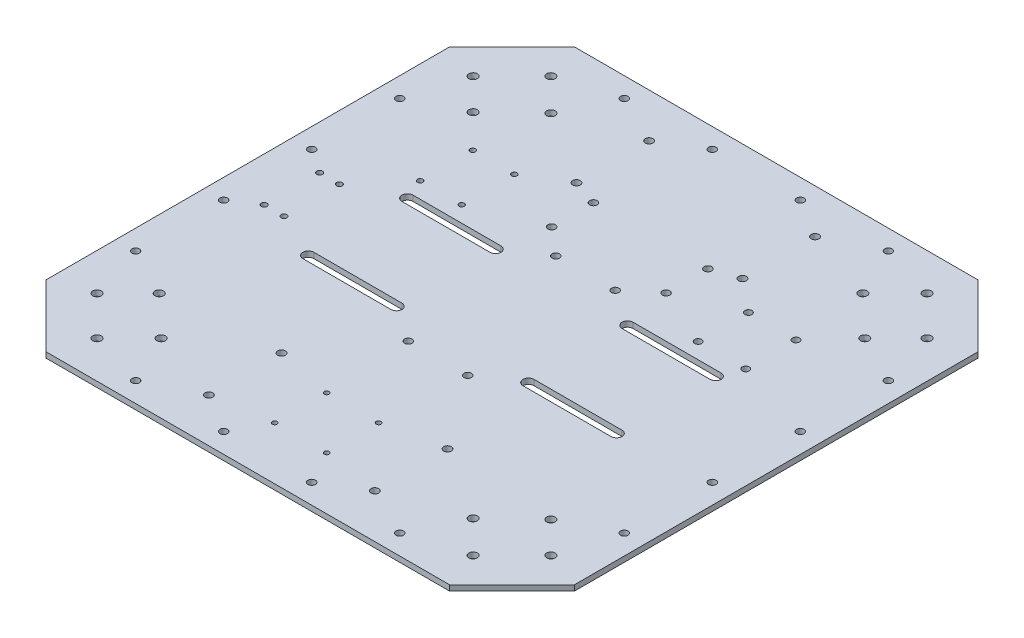
from build123d import *

# Parameters (mm, degrees)
BOSS_EXTRUDE1_DEPTH = 3.175
SKETCH2_R           = 2.4638
CUT_EXTRUDE1_DEPTH  = 6.35
SKETCH3_R           = 2.159
CUT_EXTRUDE2_DEPTH  = 6.35
SKETCH4_R           = 2.2225
CUT_EXTRUDE3_DEPTH  = 351.937720963
SKETCH5_R           = 1.651
CUT_EXTRUDE4_DEPTH  = 351.937720963
SKETCH6_R           = 2.032
SKETCH6_R_2         = 2.159
SKETCH6_R_3         = 1.397
SKETCH6_R_4         = 1.5499969
CUT_EXTRUDE5_DEPTH  = 351.937720963
SKETCH7_R           = 2.159
CUT_EXTRUDE6_DEPTH  = 351.937720963


with BuildPart() as part:
    # Sketch1 → Boss-Extrude1 (new body)
    with BuildSketch(Plane(origin=(0, 0, 0), x_dir=(1, 0, 0), z_dir=(0, 1, 0))):
        Polygon((-25.845025354, 51.656360067), (-61.766049839, 15.735335583), (-61.766049839, -217.222615449), (-25.845025354, -253.143639933), (207.112925677, -253.143639933), (243.033950161, -217.222615449), (243.033950161, 15.735335583), (207.112925677, 51.656360067), align=None)
        with BuildLine():
            ThreePointArc((52.533950161, -126.143639933), (55.708950161, -129.318639933), (52.533950161, -132.493639933))
            Line((52.533950161, -132.493639933), (1.733950161, -132.493639933))
            ThreePointArc((1.733950161, -132.493639933), (-1.441049839, -129.318639933), (1.733950161, -126.143639933))
            Line((1.733950161, -126.143639933), (52.533950161, -126.143639933))
        make_face(mode=Mode.SUBTRACT)
        with BuildLine():
            Line((179.533950161, -132.493639933), (128.733950161, -132.493639933))
            ThreePointArc((128.733950161, -132.493639933), (125.558950161, -129.318639933), (128.733950161, -126.143639933))
            Line((128.733950161, -126.143639933), (179.533950161, -126.143639933))
            ThreePointArc((179.533950161, -126.143639933), (182.708950161, -129.318639933), (179.533950161, -132.493639933))
        make_face(mode=Mode.SUBTRACT)
        with BuildLine():
            Line((1.733950161, -68.993639933), (52.533950161, -68.993639933))
            ThreePointArc((52.533950161, -68.993639933), (55.708950161, -72.168639933), (52.533950161, -75.343639933))
            Line((52.533950161, -75.343639933), (1.733950161, -75.343639933))
            ThreePointArc((1.733950161, -75.343639933), (-1.441049839, -72.168639933), (1.733950161, -68.993639933))
        make_face(mode=Mode.SUBTRACT)
        with BuildLine():
            ThreePointArc((128.733950161, -75.343639933), (125.558950161, -72.168639933), (128.733950161, -68.993639933))
            Line((128.733950161, -68.993639933), (179.533950161, -68.993639933))
            ThreePointArc((179.533950161, -68.993639933), (182.708950161, -72.168639933), (179.533950161, -75.343639933))
            Line((179.533950161, -75.343639933), (128.733950161, -75.343639933))
        make_face(mode=Mode.SUBTRACT)
    extrude(amount=BOSS_EXTRUDE1_DEPTH)

    # Sketch2 → Cut-Extrude1 (cut)
    with BuildSketch(Plane(origin=(0, 3.175, 0), x_dir=(1, 0, 0), z_dir=(0, 1, 0))):
        with Locations(Location((-17.872380726, 30.213331256, 0), (0, 0, 270))):
            Circle(SKETCH2_R)
        with Locations(Location((0.640891541, 11.70005899, 0), (0, 0, 270))):
            Circle(SKETCH2_R)
        with Locations(Location((-22.362508786, -10.197821288, 0), (0, 0, 270))):
            Circle(SKETCH2_R)
        with Locations(Location((-40.323021028, 7.762690954, 0), (0, 0, 270))):
            Circle(SKETCH2_R)
        with Locations(Location((203.630409109, -10.197821288, 0), (0, 0, 270))):
            Circle(SKETCH2_R)
        with Locations(Location((221.590921351, 7.762690954, 0), (0, 0, 270))):
            Circle(SKETCH2_R)
        with Locations(Location((180.627008782, 11.70005899, 0), (0, 0, 270))):
            Circle(SKETCH2_R)
        with Locations(Location((199.140281048, 30.213331256, 0), (0, 0, 270))):
            Circle(SKETCH2_R)
        with Locations(Location((-22.362508786, -191.289458578, 0), (0, 0, 270))):
            Circle(SKETCH2_R)
        with Locations(Location((-40.323021028, -209.24997082, 0), (0, 0, 270))):
            Circle(SKETCH2_R)
        with Locations(Location((-17.872380726, -231.700611123, 0), (0, 0, 270))):
            Circle(SKETCH2_R)
        with Locations(Location((0.640891541, -213.187338857, 0), (0, 0, 270))):
            Circle(SKETCH2_R)
        with Locations(Location((221.590921351, -209.24997082, 0), (0, 0, 270))):
            Circle(SKETCH2_R)
        with Locations(Location((199.140281048, -231.700611123, 0), (0, 0, 270))):
            Circle(SKETCH2_R)
        with Locations(Location((180.627008782, -213.187338857, 0), (0, 0, 270))):
            Circle(SKETCH2_R)
        with Locations(Location((203.630409109, -191.289458578, 0), (0, 0, 270))):
            Circle(SKETCH2_R)
    extrude(amount=-CUT_EXTRUDE1_DEPTH, mode=Mode.SUBTRACT)

    # Sketch3 → Cut-Extrude2 (cut)
    with BuildSketch(Plane(origin=(0, 3.175, 0), x_dir=(1, 0, 0), z_dir=(0, 1, 0))):
        with Locations(Location((73.361950161, -58.198639933, 0), (0, 0, 270))):
            Circle(SKETCH3_R)
        with Locations(Location((107.651950161, -58.198639933, 0), (0, 0, 270))):
            Circle(SKETCH3_R)
        with Locations(Location((73.361950161, -143.288639933, 0), (0, 0, 270))):
            Circle(SKETCH3_R)
        with Locations(Location((107.651950161, -143.288639933, 0), (0, 0, 270))):
            Circle(SKETCH3_R)
    extrude(amount=-CUT_EXTRUDE2_DEPTH, mode=Mode.SUBTRACT)

    # Sketch4 → Cut-Extrude3 (cut, through all)
    with BuildSketch(Plane(origin=(0, 3.175, 0), x_dir=(1, 0, 0), z_dir=(0, 1, 0))):
        with Locations(Location((42.754950161, 26.256360067, 0), (0, 0, 270))):
            Circle(SKETCH4_R)
        with Locations(Location((138.512950161, 26.256360067, 0), (0, 0, 270))):
            Circle(SKETCH4_R)
        with Locations(Location((42.754950161, -15.653639933, 0), (0, 0, 270))):
            Circle(SKETCH4_R)
        with Locations(Location((138.512950161, -15.653639933, 0), (0, 0, 270))):
            Circle(SKETCH4_R)
        with Locations(Location((138.512950161, -185.833639933, 0), (0, 0, 90))):
            Circle(SKETCH4_R)
        with Locations(Location((42.754950161, -185.833639933, 0), (0, 0, 90))):
            Circle(SKETCH4_R)
        with Locations(Location((138.512950161, -227.743639933, 0), (0, 0, 90))):
            Circle(SKETCH4_R)
        with Locations(Location((42.754950161, -227.743639933, 0), (0, 0, 90))):
            Circle(SKETCH4_R)
    extrude(amount=-CUT_EXTRUDE3_DEPTH, mode=Mode.SUBTRACT)

    # Sketch5 → Cut-Extrude4 (cut, through all)
    with BuildSketch(Plane(origin=(0, 3.175, 0), x_dir=(1, 0, 0), z_dir=(0, 1, 0))):
        with Locations(Location((-36.366049839, -84.741639933, 0), (0, 0, 270))):
            Circle(SKETCH5_R)
        with Locations(Location((-24.936049839, -84.741639933, 0), (0, 0, 270))):
            Circle(SKETCH5_R)
        with Locations(Location((-24.936049839, -116.745639933, 0), (0, 0, 90))):
            Circle(SKETCH5_R)
        with Locations(Location((-36.366049839, -116.745639933, 0), (0, 0, 90))):
            Circle(SKETCH5_R)
    extrude(amount=-CUT_EXTRUDE4_DEPTH, mode=Mode.SUBTRACT)

    # Sketch6 → Cut-Extrude5 (cut, through all)
    with BuildSketch(Plane(origin=(0, 3.175, 0), x_dir=(1, 0, 0), z_dir=(0, 1, 0))):
        with Locations(Location((157.181950161, -30.893639933, 0), (0, 0, 270))):
            Circle(SKETCH6_R)
        with Locations(Location((157.181950161, -59.849639933, 0), (0, 0, 270))):
            Circle(SKETCH6_R)
        with Locations(Location((184.613950161, -59.849639933, 0), (0, 0, 270))):
            Circle(SKETCH6_R)
        with Locations(Location((184.613950161, -30.893639933, 0), (0, 0, 270))):
            Circle(SKETCH6_R)
        with Locations(Location((57.613950161, -20.733639933, 0), (0, 0, 270))):
            Circle(SKETCH6_R_2)
        with Locations(Location((57.613950161, -44.863639933, 0), (0, 0, 270))):
            Circle(SKETCH6_R_2)
        with Locations(Location((123.653950161, -44.863639933, 0), (0, 0, 90))):
            Circle(SKETCH6_R_2)
        with Locations(Location((123.653950161, -20.733639933, 0), (0, 0, 90))):
            Circle(SKETCH6_R_2)
        with Locations(Location((75.647950161, -192.691639933, 0), (0, 0, 270))):
            Circle(SKETCH6_R_3)
        with Locations(Location((75.647950161, -222.663639933, 0), (0, 0, 270))):
            Circle(SKETCH6_R_3)
        with Locations(Location((105.619950161, -222.663639933, 0), (0, 0, 90))):
            Circle(SKETCH6_R_3)
        with Locations(Location((105.619950161, -192.691639933, 0), (0, 0, 90))):
            Circle(SKETCH6_R_3)
        with Locations(Location((-3.388950787, -29.369639933, 0), (0, 0, 270))):
            Circle(SKETCH6_R_4)
        with Locations(Location((-3.346049839, -59.769599662, 0), (0, 0, 270))):
            Circle(SKETCH6_R_4)
        with Locations(Location((20.611052013, -29.369639933, 0), (0, 0, 270))):
            Circle(SKETCH6_R_4)
        with Locations(Location((20.611052013, -59.769599662, 0), (0, 0, 270))):
            Circle(SKETCH6_R_4)
    extrude(amount=-CUT_EXTRUDE5_DEPTH, mode=Mode.SUBTRACT)

    # Sketch7 → Cut-Extrude6 (cut, through all)
    with BuildSketch(Plane(origin=(0, 3.175, 0), x_dir=(1, 0, 0), z_dir=(0, 1, 0))):
        with Locations(Location((65.233950161, 40.226360067, 0), (0, 0, 270))):
            Circle(SKETCH7_R)
        with Locations(Location((14.433950161, 40.226360067, 0), (0, 0, 270))):
            Circle(SKETCH7_R)
        with Locations(Location((-50.336049839, -75.343639933, 0), (0, 0, 270))):
            Circle(SKETCH7_R)
        with Locations(Location((-50.336049839, -24.543639933, 0), (0, 0, 270))):
            Circle(SKETCH7_R)
        with Locations(Location((231.603950161, -24.543639933, 0), (0, 0, 90))):
            Circle(SKETCH7_R)
        with Locations(Location((231.603950161, -75.343639933, 0), (0, 0, 90))):
            Circle(SKETCH7_R)
        with Locations(Location((166.833950161, 40.226360067, 0), (0, 0, 90))):
            Circle(SKETCH7_R)
        with Locations(Location((116.033950161, 40.226360067, 0), (0, 0, 90))):
            Circle(SKETCH7_R)
        with Locations(Location((116.033950161, -241.713639933, 0), (0, 0, 270))):
            Circle(SKETCH7_R)
        with Locations(Location((166.833950161, -241.713639933, 0), (0, 0, 270))):
            Circle(SKETCH7_R)
        with Locations(Location((231.603950161, -126.143639933, 0), (0, 0, 270))):
            Circle(SKETCH7_R)
        with Locations(Location((231.603950161, -176.943639933, 0), (0, 0, 270))):
            Circle(SKETCH7_R)
        with Locations(Location((-50.336049839, -176.943639933, 0), (0, 0, 90))):
            Circle(SKETCH7_R)
        with Locations(Location((-50.336049839, -126.143639933, 0), (0, 0, 90))):
            Circle(SKETCH7_R)
        with Locations(Location((14.433950161, -241.713639933, 0), (0, 0, 90))):
            Circle(SKETCH7_R)
        with Locations(Location((65.233950161, -241.713639933, 0), (0, 0, 90))):
            Circle(SKETCH7_R)
    extrude(amount=-CUT_EXTRUDE6_DEPTH, mode=Mode.SUBTRACT)


solid = part.part
